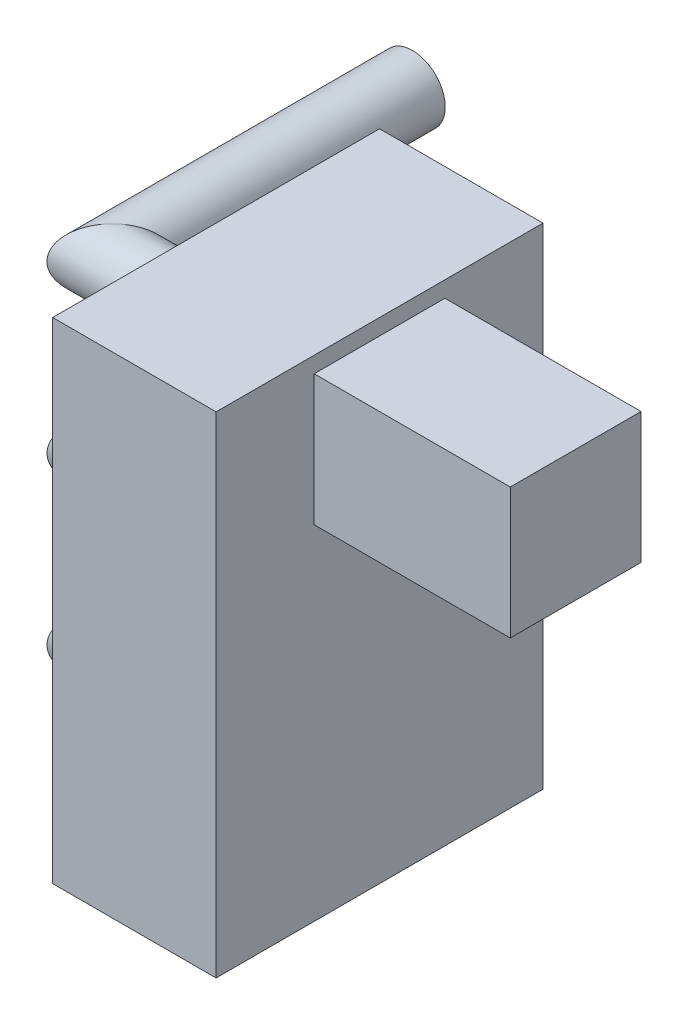
from build123d import *

# Parameters (mm, degrees)
SKETCH_1_W      = 2.5
SKETCH_1_H      = 7.5
EXTRUDE_1_DEPTH = 5
SKETCH_2_W      = 2
SKETCH_2_H      = 2
EXTRUDE_2_DEPTH = 3
SKETCH_3_R      = 0.5


with BuildPart() as part:
    # 草图1 → 凸台-拉伸1 (new body)
    with BuildSketch(Plane.XY):
        with Locations((1.25, -10.035009445)):
            Rectangle(SKETCH_1_W, SKETCH_1_H)
    extrude(amount=EXTRUDE_1_DEPTH)

    # 草图2 → 凸台-拉伸2 (add)
    with BuildSketch(Plane(origin=(2.5, 0, 0), x_dir=(0, 0, -1), z_dir=(1, 0, 0))):
        with Locations((-2.5, -7.530464336)):
            Rectangle(SKETCH_2_W, SKETCH_2_H)
    extrude(amount=EXTRUDE_2_DEPTH)

    # 扫描1: sweep along a path in 草图4
    with BuildLine(Plane.XZ.offset(10.035009445)) as sweep_1_path:
        Line((0, 3.097044355), (-2, 3.097044355))
        Line((-2, 3.097044355), (-2, -2))
    # 草图3 → 扫描1 (sweep)
    with BuildSketch(Plane.ZY):
        with Locations((2.592115007, -10.035009445)):
            Circle(SKETCH_3_R)
        with Locations((2.592115007, -7.495009445)):
            Circle(SKETCH_3_R)
        with Locations((2.592115007, -12.575009445)):
            Circle(SKETCH_3_R)
    sweep(path=sweep_1_path.line, transition=Transition.RIGHT)


solid = part.part
